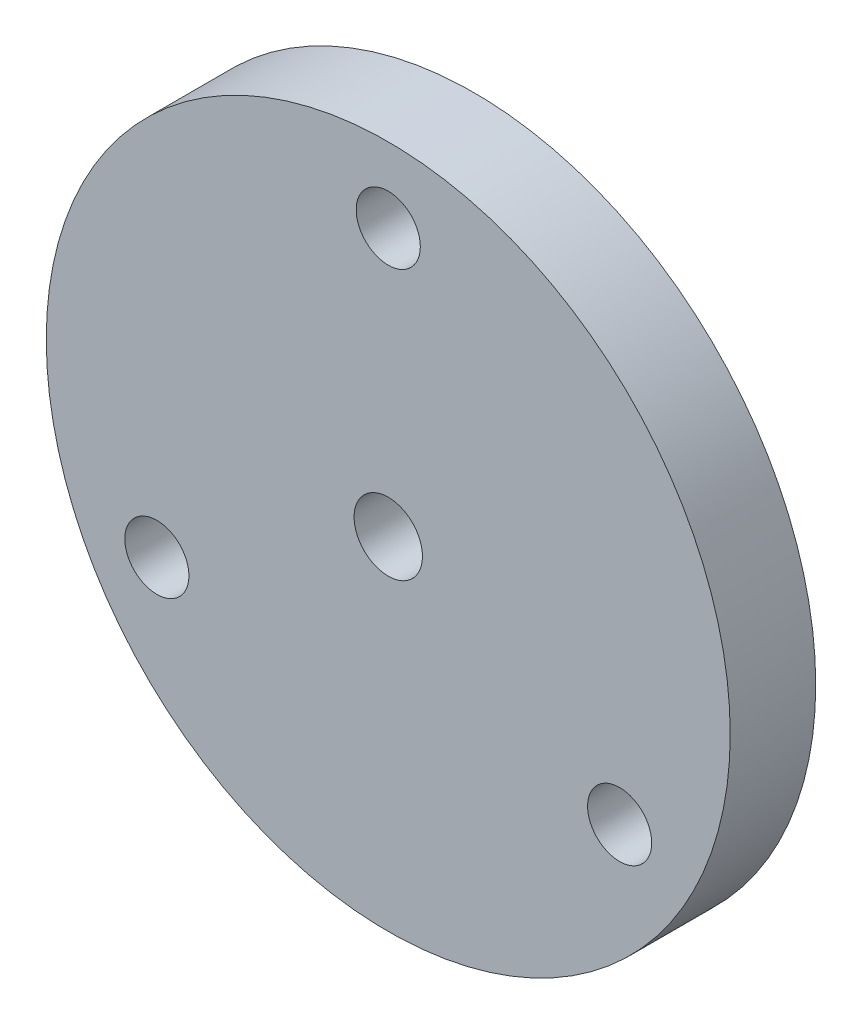
from build123d import *

# Parameters (mm, degrees)
CROQUIS1_R              = 16
CROQUIS1_R_2            = 1.5
CROQUIS1_R_3            = 1.6
SALIENTE_EXTRUIR1_DEPTH = 4


with BuildPart() as part:
    # Croquis1 → Saliente-Extruir1 (new body)
    with BuildSketch(Plane.XY):
        Circle(CROQUIS1_R)
        with Locations((0, 12.5)):
            Circle(CROQUIS1_R_2, mode=Mode.SUBTRACT)
        with Locations((10.825317547, -6.25)):
            Circle(CROQUIS1_R_2, mode=Mode.SUBTRACT)
        with Locations((-10.825317547, -6.25)):
            Circle(CROQUIS1_R_2, mode=Mode.SUBTRACT)
        Circle(CROQUIS1_R_3, mode=Mode.SUBTRACT)
    extrude(amount=SALIENTE_EXTRUIR1_DEPTH)


solid = part.part
